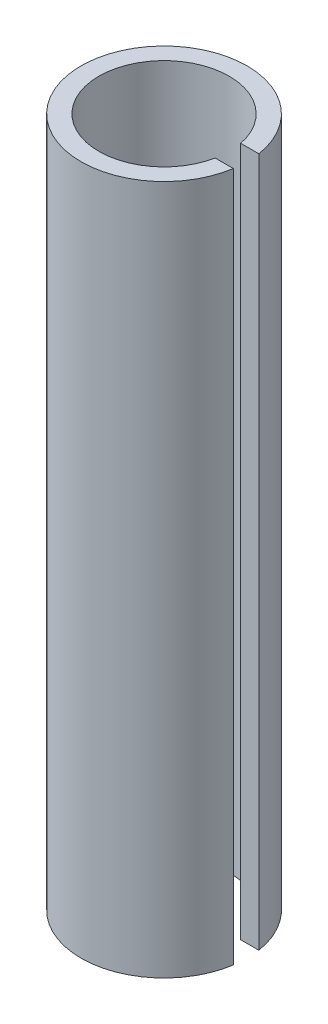
from build123d import *

# Parameters (mm, degrees)
BOSS_EXTRUDE1_DEPTH = 27


with BuildPart() as part:
    # Sketch1 → Boss-Extrude1 (new body)
    with BuildSketch(Plane(origin=(0, 0, 0), x_dir=(1, 0, 0), z_dir=(0, 1, 0))):
        with BuildLine():
            ThreePointArc((2.50049995, -0.5), (-2.55, 0), (2.50049995, 0.5))
            Line((2.50049995, 0.5), (3.211308145, 0.5))
            ThreePointArc((3.211308145, 0.5), (-3.25, 0), (3.211308145, -0.5))
            Line((3.211308145, -0.5), (2.50049995, -0.5))
        make_face()
    extrude(amount=BOSS_EXTRUDE1_DEPTH)


solid = part.part
